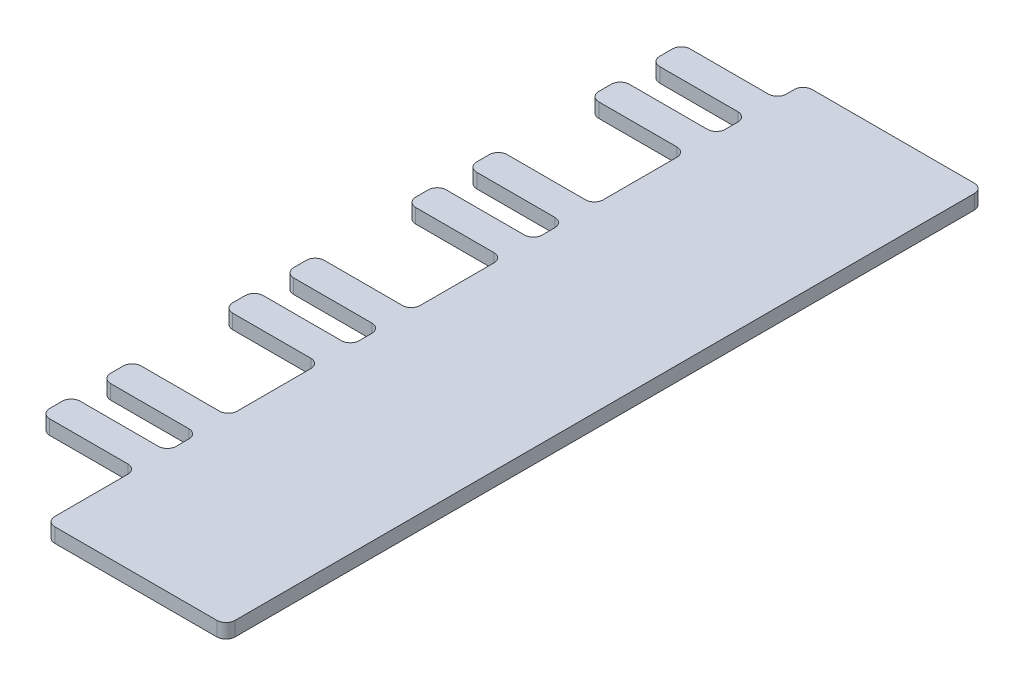
from build123d import *

# Parameters (mm, degrees)
BOSS_EXTRUDE1_DEPTH = 1.2


with BuildPart() as part:
    # Sketch1 → Boss-Extrude1 (new body)
    with BuildSketch(Plane(origin=(0, 0, 0), x_dir=(1, 0, 0), z_dir=(0, 1, 0))):
        with BuildLine():
            Line((-0.75, 7.5725), (-7.25, 7.5725))
            ThreePointArc((-7.25, 7.5725), (-7.780330086, 7.792169914), (-8, 8.3225))
            Line((-8, 8.3225), (-8, 9.3625))
            ThreePointArc((-8, 9.3625), (-7.780330086, 9.892830086), (-7.25, 10.1125))
            Line((-7.25, 10.1125), (-0.746230206, 10.1125))
            ThreePointArc((-0.746230206, 10.1125), (-0.243153345, 10.306250351), (0, 10.787396874))
            Line((0, 10.787396874), (0, 11.9025))
            ThreePointArc((0, 11.9025), (-0.219669914, 12.432830086), (-0.75, 12.6525))
            Line((-0.75, 12.6525), (-7.25, 12.6525))
            ThreePointArc((-7.25, 12.6525), (-7.780330086, 12.872169914), (-8, 13.4025))
            Line((-8, 13.4025), (-8, 14.4425))
            ThreePointArc((-8, 14.4425), (-7.780330086, 14.972830086), (-7.25, 15.1925))
            Line((-7.25, 15.1925), (-0.746230206, 15.1925))
            ThreePointArc((-0.746230206, 15.1925), (-0.243153345, 15.386250351), (0, 15.867396874))
            Line((0, 15.867396874), (0, 22.0625))
            ThreePointArc((0, 22.0625), (-0.219669914, 22.592830086), (-0.75, 22.8125))
            Line((-0.75, 22.8125), (-7.25, 22.8125))
            ThreePointArc((-7.25, 22.8125), (-7.780330086, 23.032169914), (-8, 23.5625))
            Line((-8, 23.5625), (-8, 24.6025))
            ThreePointArc((-8, 24.6025), (-7.780330086, 25.132830086), (-7.25, 25.3525))
            Line((-7.25, 25.3525), (-0.746230206, 25.3525))
            ThreePointArc((-0.746230206, 25.3525), (-0.243153345, 25.546250351), (0, 26.027396874))
            Line((0, 26.027396874), (0, 27.1425))
            ThreePointArc((0, 27.1425), (-0.219669914, 27.672830086), (-0.75, 27.8925))
            Line((-0.75, 27.8925), (-7.25, 27.8925))
            ThreePointArc((-7.25, 27.8925), (-7.780330086, 28.112169914), (-8, 28.6425))
            Line((-8, 28.6425), (-8, 29.6825))
            ThreePointArc((-8, 29.6825), (-7.780330086, 30.212830086), (-7.25, 30.4325))
            Line((-7.25, 30.4325), (-0.746230206, 30.4325))
            ThreePointArc((-0.746230206, 30.4325), (-0.243153345, 30.626250351), (0, 31.107396874))
            Line((0, 31.107396874), (0, 37.3025))
            ThreePointArc((0, 37.3025), (-0.219669914, 37.832830086), (-0.75, 38.0525))
            Line((-0.75, 38.0525), (-7.25, 38.0525))
            ThreePointArc((-7.25, 38.0525), (-7.780330086, 38.272169914), (-8, 38.8025))
            Line((-8, 38.8025), (-8, 39.8425))
            ThreePointArc((-8, 39.8425), (-7.780330086, 40.372830086), (-7.25, 40.5925))
            Line((-7.25, 40.5925), (-0.746230206, 40.5925))
            ThreePointArc((-0.746230206, 40.5925), (-0.243153345, 40.786250351), (0, 41.267396874))
            Line((0, 41.267396874), (0, 42.3825))
            ThreePointArc((0, 42.3825), (-0.219669914, 42.912830086), (-0.75, 43.1325))
            Line((-0.75, 43.1325), (-7.25, 43.1325))
            ThreePointArc((-7.25, 43.1325), (-7.780330086, 43.352169914), (-8, 43.8825))
            Line((-8, 43.8825), (-8, 44.9225))
            ThreePointArc((-8, 44.9225), (-7.780330086, 45.452830086), (-7.25, 45.6725))
            Line((-7.25, 45.6725), (-0.746230206, 45.6725))
            ThreePointArc((-0.746230206, 45.6725), (-0.243153345, 45.866250351), (0, 46.347396874))
            Line((0, 46.347396874), (0, 52.5425))
            ThreePointArc((0, 52.5425), (-0.219669914, 53.072830086), (-0.75, 53.2925))
            Line((-0.75, 53.2925), (-7.25, 53.2925))
            ThreePointArc((-7.25, 53.2925), (-7.780330086, 53.512169914), (-8, 54.0425))
            Line((-8, 54.0425), (-8, 55.0825))
            ThreePointArc((-8, 55.0825), (-7.780330086, 55.612830086), (-7.25, 55.8325))
            Line((-7.25, 55.8325), (-0.746230206, 55.8325))
            ThreePointArc((-0.746230206, 55.8325), (-0.243153345, 56.026250351), (0, 56.507396874))
            Line((0, 56.507396874), (0, 57.6225))
            ThreePointArc((0, 57.6225), (-0.219669914, 58.152830086), (-0.75, 58.3725))
            Line((-0.75, 58.3725), (-7.25, 58.3725))
            ThreePointArc((-7.25, 58.3725), (-7.780330086, 58.592169914), (-8, 59.1225))
            Line((-8, 59.1225), (-8, 60.1625))
            ThreePointArc((-8, 60.1625), (-7.780330086, 60.692830086), (-7.25, 60.9125))
            Line((-7.25, 60.9125), (-0.746230206, 60.9125))
            ThreePointArc((-0.746230206, 60.9125), (-0.243153345, 61.106250351), (0, 61.587396874))
            Line((0, 61.587396874), (0, 62.3125))
            ThreePointArc((0, 62.3125), (0.219669914, 62.842830086), (0.75, 63.0625))
            Line((0.75, 63.0625), (14.25, 63.0625))
            ThreePointArc((14.25, 63.0625), (14.780330086, 62.842830086), (15, 62.3125))
            Line((15, 62.3125), (15, 0.75))
            ThreePointArc((15, 0.75), (14.780330086, 0.219669914), (14.25, 0))
            Line((14.25, 0), (0.75, 0))
            ThreePointArc((0.75, 0), (0.219669914, 0.219669914), (0, 0.75))
            Line((0, 0.75), (0, 6.8225))
            ThreePointArc((0, 6.8225), (-0.219669914, 7.352830086), (-0.75, 7.5725))
        make_face()
    extrude(amount=BOSS_EXTRUDE1_DEPTH)


solid = part.part
